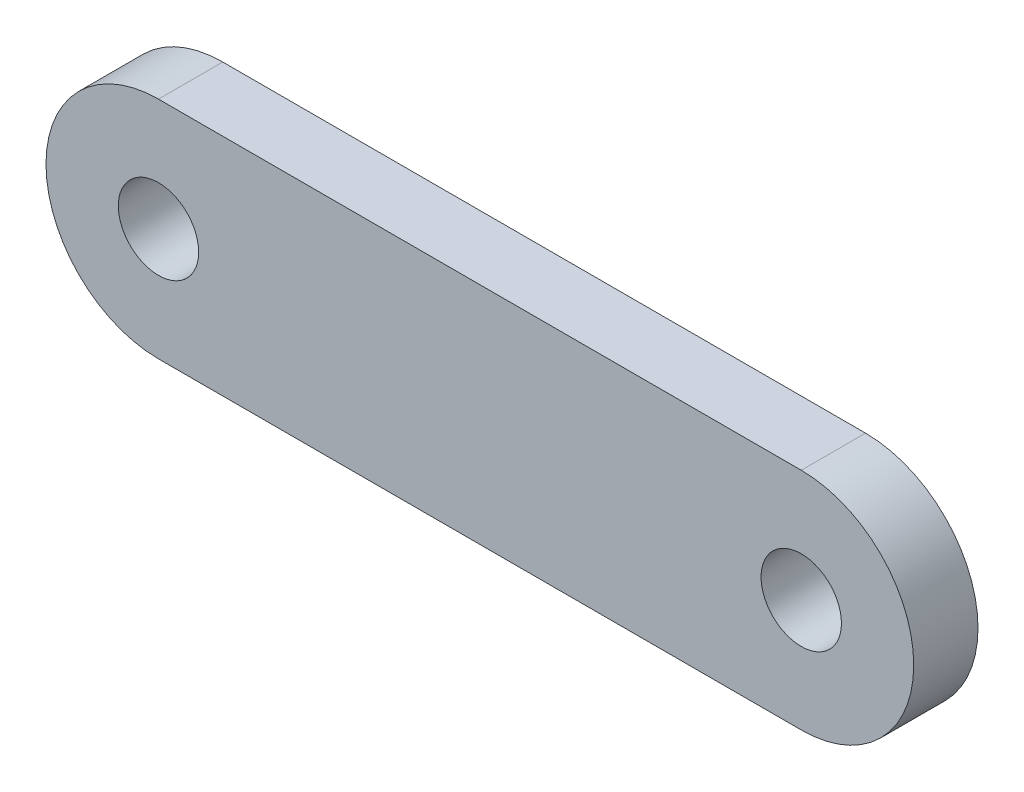
from build123d import *

# Parameters (mm, degrees)
ESQUISSE1_R        = 2.5
BOSS_EXTRU_1_DEPTH = 4


with BuildPart() as part:
    # Esquisse1 → Boss.-Extru.1 (new body)
    with BuildSketch(Plane.XY):
        with BuildLine():
            Line((0, 7), (40, 7))
            ThreePointArc((40, 7), (47, 0), (40, -7))
            Line((40, -7), (0, -7))
            ThreePointArc((0, -7), (-7, 0), (0, 7))
        make_face()
        Circle(ESQUISSE1_R, mode=Mode.SUBTRACT)
        with Locations((40, 0)):
            Circle(ESQUISSE1_R, mode=Mode.SUBTRACT)
    extrude(amount=BOSS_EXTRU_1_DEPTH)


solid = part.part
